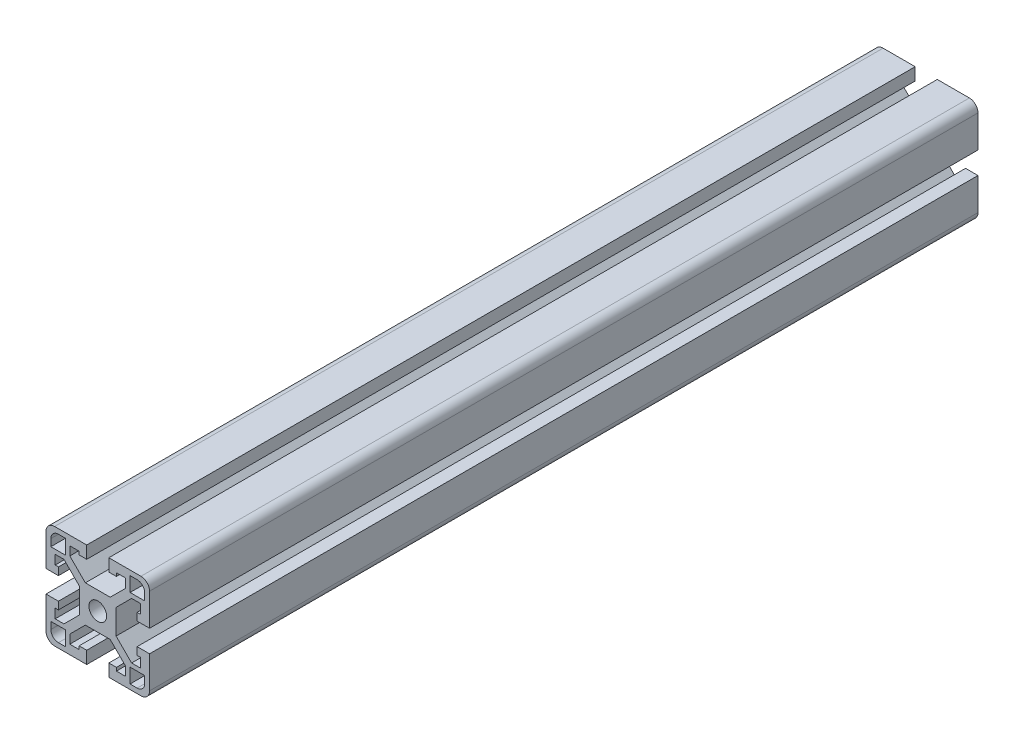
from build123d import *

# Parameters (mm, degrees)
SKETCH1_R           = 3.2639
BOSS_EXTRUDE1_DEPTH = 152.4


with BuildPart() as part:
    # Sketch1 → Boss-Extrude1 (new, symmetric)
    with BuildSketch(Plane.XY):
        with BuildLine():
            Line((-6.731, 4.575738531), (-6.731, -4.575738531))
            Line((-6.731, -4.575738531), (-12.442261469, -10.287))
            Line((-12.442261469, -10.287), (-15.6718, -10.287))
            Line((-15.6718, -10.287), (-15.6718, -6.858))
            Line((-15.6718, -6.858), (-14.478, -6.858))
            Line((-14.478, -6.858), (-14.478, -4.064))
            Line((-14.478, -4.064), (-19.05, -4.064))
            Line((-19.05, -4.064), (-19.05, -15.875))
            ThreePointArc((-19.05, -15.875), (-18.12006403, -18.12006403), (-15.875, -19.05))
            Line((-15.875, -19.05), (-4.064, -19.05))
            Line((-4.064, -19.05), (-4.064, -14.478))
            Line((-4.064, -14.478), (-6.858, -14.478))
            Line((-6.858, -14.478), (-6.858, -15.6718))
            Line((-6.858, -15.6718), (-10.287, -15.6718))
            Line((-10.287, -15.6718), (-10.287, -12.442261469))
            Line((-10.287, -12.442261469), (-4.575738531, -6.731))
            Line((-4.575738531, -6.731), (4.575738531, -6.731))
            Line((4.575738531, -6.731), (10.287, -12.442261469))
            Line((10.287, -12.442261469), (10.287, -15.6718))
            Line((10.287, -15.6718), (6.858, -15.6718))
            Line((6.858, -15.6718), (6.858, -14.478))
            Line((6.858, -14.478), (4.064, -14.478))
            Line((4.064, -14.478), (4.064, -19.05))
            Line((4.064, -19.05), (15.875, -19.05))
            ThreePointArc((15.875, -19.05), (18.12006403, -18.12006403), (19.05, -15.875))
            Line((19.05, -15.875), (19.05, -4.064))
            Line((19.05, -4.064), (14.478, -4.064))
            Line((14.478, -4.064), (14.478, -6.858))
            Line((14.478, -6.858), (15.6718, -6.858))
            Line((15.6718, -6.858), (15.6718, -10.287))
            Line((15.6718, -10.287), (12.442261469, -10.287))
            Line((12.442261469, -10.287), (6.731, -4.575738531))
            Line((6.731, -4.575738531), (6.731, 4.575738531))
            Line((6.731, 4.575738531), (12.442261469, 10.287))
            Line((12.442261469, 10.287), (15.6718, 10.287))
            Line((15.6718, 10.287), (15.6718, 6.858))
            Line((15.6718, 6.858), (14.478, 6.858))
            Line((14.478, 6.858), (14.478, 4.064))
            Line((14.478, 4.064), (19.05, 4.064))
            Line((19.05, 4.064), (19.05, 15.875))
            ThreePointArc((19.05, 15.875), (18.12006403, 18.12006403), (15.875, 19.05))
            Line((15.875, 19.05), (4.064, 19.05))
            Line((4.064, 19.05), (4.064, 14.478))
            Line((4.064, 14.478), (6.858, 14.478))
            Line((6.858, 14.478), (6.858, 15.6718))
            Line((6.858, 15.6718), (10.287, 15.6718))
            Line((10.287, 15.6718), (10.287, 12.442261469))
            Line((10.287, 12.442261469), (4.575738531, 6.731))
            Line((4.575738531, 6.731), (-4.575738531, 6.731))
            Line((-4.575738531, 6.731), (-10.287, 12.442261469))
            Line((-10.287, 12.442261469), (-10.287, 15.6718))
            Line((-10.287, 15.6718), (-6.858, 15.6718))
            Line((-6.858, 15.6718), (-6.858, 14.478))
            Line((-6.858, 14.478), (-4.064, 14.478))
            Line((-4.064, 14.478), (-4.064, 19.05))
            Line((-4.064, 19.05), (-15.875, 19.05))
            ThreePointArc((-15.875, 19.05), (-18.12006403, 18.12006403), (-19.05, 15.875))
            Line((-19.05, 15.875), (-19.05, 4.064))
            Line((-19.05, 4.064), (-14.478, 4.064))
            Line((-14.478, 4.064), (-14.478, 6.858))
            Line((-14.478, 6.858), (-15.6718, 6.858))
            Line((-15.6718, 6.858), (-15.6718, 10.287))
            Line((-15.6718, 10.287), (-12.442261469, 10.287))
            Line((-12.442261469, 10.287), (-6.731, 4.575738531))
        make_face()
        with Locations(Location((0, 0, 0), (0, 0, 180))):
            Circle(SKETCH1_R, mode=Mode.SUBTRACT)
        with BuildLine():
            Line((-11.8872, 17.272), (-14.478, 17.272))
            ThreePointArc((-14.478, 17.272), (-16.453656347, 16.453656347), (-17.272, 14.478))
            Line((-17.272, 14.478), (-17.272, 11.8872))
            Line((-17.272, 11.8872), (-11.8872, 11.8872))
            Line((-11.8872, 11.8872), (-11.8872, 17.272))
        make_face(mode=Mode.SUBTRACT)
        with BuildLine():
            Line((14.478, 17.272), (11.8872, 17.272))
            Line((11.8872, 17.272), (11.8872, 11.8872))
            Line((11.8872, 11.8872), (17.272, 11.8872))
            Line((17.272, 11.8872), (17.272, 14.478))
            ThreePointArc((17.272, 14.478), (16.453656347, 16.453656347), (14.478, 17.272))
        make_face(mode=Mode.SUBTRACT)
        with BuildLine():
            Line((11.8872, -17.272), (14.478, -17.272))
            ThreePointArc((14.478, -17.272), (16.453656347, -16.453656347), (17.272, -14.478))
            Line((17.272, -14.478), (17.272, -11.8872))
            Line((17.272, -11.8872), (11.8872, -11.8872))
            Line((11.8872, -11.8872), (11.8872, -17.272))
        make_face(mode=Mode.SUBTRACT)
        with BuildLine():
            Line((-14.478, -17.272), (-11.8872, -17.272))
            Line((-11.8872, -17.272), (-11.8872, -11.8872))
            Line((-11.8872, -11.8872), (-17.272, -11.8872))
            Line((-17.272, -11.8872), (-17.272, -14.478))
            ThreePointArc((-17.272, -14.478), (-16.453656347, -16.453656347), (-14.478, -17.272))
        make_face(mode=Mode.SUBTRACT)
    extrude(amount=BOSS_EXTRUDE1_DEPTH, both=True)


solid = part.part
